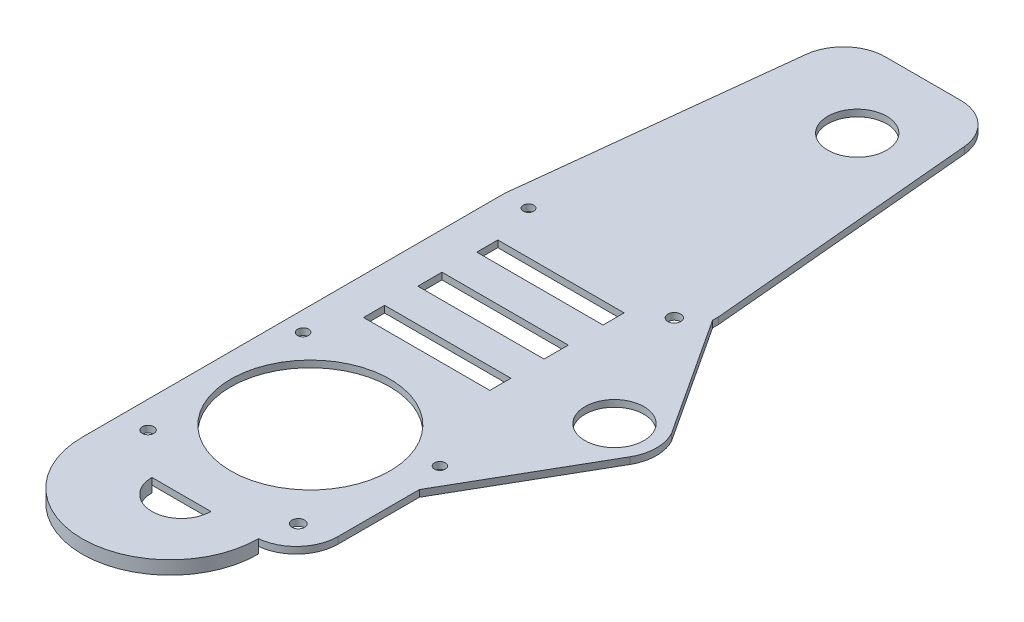
from build123d import *

# Parameters (mm, degrees)
SKETCH1_R           = 2.875
SKETCH1_R_2         = 7
BOSS_EXTRUDE1_DEPTH = 24.5875
SKETCH4_W           = 66.272407177
SKETCH4_H           = 27.800260981
CUT_EXTRUDE2_DEPTH  = 20
FILLET3_R           = 10
FILLET4_R           = 10
BOSS_EXTRUDE3_START = -1.5875
BOSS_EXTRUDE3_DEPTH = 1.5875
SKETCH7_R           = 7
CUT_EXTRUDE3_DEPTH  = 1.5875
CUT_EXTRUDE4_START  = -10
SKETCH8_R           = 3
SKETCH8_R_2         = 18.9
SKETCH8_R_3         = 2.875
SKETCH8_R_4         = 7
CUT_EXTRUDE4_DEPTH  = 10
SKETCH9_W           = 229.1070397
SKETCH9_H           = 361.266964835
SKETCH9_R           = 1.388229101
SKETCH9_R_2         = 1.483383261
SKETCH9_R_3         = 1.314910669
SKETCH9_R_4         = 1.248623853
SKETCH9_R_5         = 1.255629307
SKETCH9_R_6         = 1.53911217
CUT_EXTRUDE5_DEPTH  = 13
SKETCH10_W          = 29.988446547
SKETCH10_H          = 5
SKETCH10_H_2        = 5.75
CUT_EXTRUDE6_DEPTH  = 22
SKETCH11_R          = 5.236653548
CUT_EXTRUDE7_DEPTH  = 10
BOSS_EXTRUDE4_START = -1.59
BOSS_EXTRUDE4_DEPTH = 1.59
SKETCH13_R          = 7
CUT_EXTRUDE8_DEPTH  = 41
SKETCH14_W          = 61.491848917
SKETCH14_H          = 35.587491391
CUT_EXTRUDE9_DEPTH  = 20
FILLET5_R           = 10
SKETCH16_W          = 163.723031551
SKETCH16_H          = 22.872070304
CUT_EXTRUDE11_DEPTH = 35
FILLET6_R           = 10
SKETCH17_R          = 1.53911217
SKETCH17_R_2        = 1.255629307
SKETCH17_R_3        = 1.3
SKETCH17_R_4        = 1.314910669
SKETCH17_R_5        = 1.388229101
SKETCH17_R_6        = 1.5
CUT_EXTRUDE12_DEPTH = 42
CUT_EXTRUDE13_START = -30
SKETCH18_R          = 18.9
CUT_EXTRUDE13_DEPTH = 30
BOSS_EXTRUDE5_DEPTH = 3.175


with BuildPart() as part:
    # Sketch1 → Boss-Extrude1 (new body)
    with BuildSketch(Plane(origin=(0, 0, 0), x_dir=(1, 0, 0), z_dir=(0, 1, 0))):
        with BuildLine():
            Line((42.32729629, 228.6), (10.454309325, 228.6))
            Line((10.454309325, 228.6), (0, 135.362739137))
            Line((0, 135.362739137), (0, 0))
            Line((0, 0), (24.327009544, 0))
            Line((24.327009544, 0), (50.8, 0))
            Line((50.8, 0), (50.8, 64.87909603))
            Line((50.8, 64.87909603), (50.8, 87.423477361))
            Line((50.8, 87.423477361), (50.8, 98.200996728))
            ThreePointArc((50.8, 98.200996728), (50.4, 101.000996728), (50.8, 103.800996728))
            Line((50.8, 103.800996728), (50.8, 104.488200565))
            Line((50.8, 104.488200565), (50.8, 120.619222808))
            Line((50.8, 120.619222808), (50.8, 135.362739137))
            Line((50.8, 135.362739137), (42.32729629, 228.6))
        make_face()
        with Locations(Location((24.101759227, 108.78493524, 0), (0, 0, 270))):
            Circle(SKETCH1_R, mode=Mode.SUBTRACT)
        with Locations(Location((29.504213454, 189.557234372, 0), (0, 0, 270))):
            Circle(SKETCH1_R_2, mode=Mode.SUBTRACT)
    extrude(amount=BOSS_EXTRUDE1_DEPTH)

    # Sketch4 → Cut-Extrude2 (cut)
    with BuildSketch(Plane(origin=(0, 0, -228.6), x_dir=(-1, 0, 0), z_dir=(0, 0, -1))):
        with Locations((-28.174690156, -1.980940155)):
            Rectangle(SKETCH4_W, SKETCH4_H)
    extrude(amount=-CUT_EXTRUDE2_DEPTH, mode=Mode.SUBTRACT)

    # Fillet3
    fillet3_edges = [part.edges().sort_by_distance(p)[0] for p in [
        (44.144746445, 5.959595168, -208.6),
    ]]
    fillet(fillet3_edges, radius=FILLET3_R)

    # Fillet4
    fillet4_edges = [part.edges().sort_by_distance(p)[0] for p in [
        (50.8, 12.29375, 0),
        (0, 12.29375, 0),
        (8.211791854, 5.959595168, -208.6),
    ]]
    fillet(fillet4_edges, radius=FILLET4_R)

    # Sketch6 → Boss-Extrude3 (add)
    with BuildSketch(Plane(origin=(0, 24.5875, 0), x_dir=(1, 0, 0), z_dir=(0, 1, 0)).offset(BOSS_EXTRUDE3_START)):
        with BuildLine():
            Line((50.8, 135.362739137), (50.8, 103.800996728))
            ThreePointArc((50.8, 103.800996728), (50.4, 101.000996728), (50.8, 98.200996728))
            Line((50.8, 98.200996728), (50.8, 61.124243317))
            Line((50.8, 61.124243317), (69.258211507, 96.360728536))
            ThreePointArc((69.258211507, 96.360728536), (70.393157133, 101.370875786), (68.890940865, 106.283413148))
            Line((68.890940865, 106.283413148), (50.8, 135.362739137))
        make_face()
    extrude(amount=BOSS_EXTRUDE3_DEPTH)

    # Sketch7 → Cut-Extrude3 (cut)
    with BuildSketch(Plane(origin=(0, 24.5875, 0), x_dir=(1, 0, 0), z_dir=(0, 1, 0))):
        with Locations(Location((60.4, 101.000996728, 0), (0, 0, 270))):
            Circle(SKETCH7_R)
    extrude(amount=-CUT_EXTRUDE3_DEPTH, mode=Mode.SUBTRACT)

    # Sketch8 → Cut-Extrude4 (cut)
    with BuildSketch(Plane(origin=(0, 24.5875, 0), x_dir=(1, 0, 0), z_dir=(0, 1, 0)).offset(CUT_EXTRUDE4_START)):
        with BuildLine():
            Line((10.454309325, 228.6), (0, 135.362739137))
            Line((0, 135.362739137), (0, 10))
            ThreePointArc((0, 10), (2.928932188, 2.928932188), (10, 0))
            Line((10, 0), (40.8, 0))
            ThreePointArc((40.8, 0), (47.871067812, 2.928932188), (50.8, 10))
            Line((50.8, 10), (50.8, 61.124243317))
            Line((50.8, 61.124243317), (69.258211507, 96.360728536))
            ThreePointArc((69.258211507, 96.360728536), (70.393157133, 101.370875786), (68.890940865, 106.283413148))
            Line((68.890940865, 106.283413148), (50.8, 135.362739137))
            Line((50.8, 135.362739137), (42.32729629, 228.6))
            Line((42.32729629, 228.6), (10.454309325, 228.6))
        make_face()
        with Locations(Location((9.492033273, 118.909935242, 0), (0, 0, 270))):
            Circle(SKETCH8_R, mode=Mode.SUBTRACT)
        with Locations(Location((24.583834565, 64.593886665, 0), (0, 0, 270))):
            Circle(SKETCH8_R_2, mode=Mode.SUBTRACT)
        with Locations(Location((24.101759227, 108.78493524, 0), (0, 0, 270))):
            Circle(SKETCH8_R_3, mode=Mode.SUBTRACT)
        with Locations((60.4, 101.000996728)):
            Circle(SKETCH8_R_4, mode=Mode.SUBTRACT)
        with Locations(Location((29.504213454, 189.557234372, 0), (0, 0, 270))):
            Circle(SKETCH8_R_4, mode=Mode.SUBTRACT)
    extrude(amount=CUT_EXTRUDE4_DEPTH, mode=Mode.SUBTRACT)

    # Sketch9 → Cut-Extrude5 (cut)
    with BuildSketch(Plane.XZ):
        with Locations((19.903204009, -125.752229467)):
            Rectangle(SKETCH9_W, SKETCH9_H)
        with Locations(Location((6.335590122, -44.288799513, 0), (0, 0, 270))):
            Circle(SKETCH9_R, mode=Mode.SUBTRACT)
        with Locations(Location((43.447673368, -42.868436544, 0), (0, 0, 270))):
            Circle(SKETCH9_R_2, mode=Mode.SUBTRACT)
        with Locations(Location((4.659546827, -82.793173401, 0), (0, 0, 270))):
            Circle(SKETCH9_R_3, mode=Mode.SUBTRACT)
        with Locations(Location((48.400988852, -71.551011715, 0), (0, 0, 270))):
            Circle(SKETCH9_R_4, mode=Mode.SUBTRACT)
        with Locations(Location((5.88467603, -135.103145298, 0), (0, 0, 270))):
            Circle(SKETCH9_R_5, mode=Mode.SUBTRACT)
        with Locations(Location((45.747747887, -129.863467374, 0), (0, 0, 270))):
            Circle(SKETCH9_R_6, mode=Mode.SUBTRACT)
    extrude(amount=-CUT_EXTRUDE5_DEPTH, mode=Mode.SUBTRACT)

    # Sketch10 → Cut-Extrude6 (cut)
    with BuildSketch(Plane(origin=(0, 24.5875, 0), x_dir=(1, 0, 0), z_dir=(0, 1, 0))):
        with Locations((23.779803557, 122.41493524)):
            Rectangle(SKETCH10_W, SKETCH10_H)
        with Locations((23.779803557, 108.78493524)):
            Rectangle(SKETCH10_W, SKETCH10_H_2)
        with Locations((23.779803557, 95.528937895)):
            Rectangle(SKETCH10_W, SKETCH10_H)
    extrude(amount=-CUT_EXTRUDE6_DEPTH, mode=Mode.SUBTRACT)

    # Sketch11 → Cut-Extrude7 (cut)
    with BuildSketch(Plane(origin=(0, 24.5875, 0), x_dir=(1, 0, 0), z_dir=(0, 1, 0))):
        with Locations((8.535526315, 118.29502971)):
            Circle(SKETCH11_R)
    extrude(amount=-CUT_EXTRUDE7_DEPTH, mode=Mode.SUBTRACT)

    # Sketch12 → Boss-Extrude4 (add)
    with BuildSketch(Plane(origin=(0, 14.5875, 0), x_dir=(1, 0, 0), z_dir=(0, 1, 0)).offset(BOSS_EXTRUDE4_START)):
        with BuildLine():
            Line((68.287536191, 107.148091395), (50.8, 133.900488173))
            Line((50.8, 133.900488173), (50.8, 103.800996728))
            ThreePointArc((50.8, 103.800996728), (58.520134646, 110.822712782), (68.287536191, 107.148091395))
        make_face()
        with BuildLine():
            Line((69.19540964, 105.759228466), (68.287536191, 107.148091395))
            ThreePointArc((68.287536191, 107.148091395), (58.520134646, 110.822712782), (50.8, 103.800996728))
            ThreePointArc((50.8, 103.800996728), (50.4, 101.000996728), (50.8, 98.200996728))
            ThreePointArc((50.8, 98.200996728), (59.211240578, 91.07190558), (69.067690563, 96.013899345))
            ThreePointArc((69.067690563, 96.013899345), (70.061182785, 98.419999404), (70.4, 101.000996728))
            ThreePointArc((70.4, 101.000996728), (70.094175994, 103.455167016), (69.19540964, 105.759228466))
        make_face()
        with BuildLine():
            ThreePointArc((69.067690563, 96.013899345), (59.211240578, 91.07190558), (50.8, 98.200996728))
            Line((50.8, 98.200996728), (50.8, 64.264230765))
            Line((50.8, 64.264230765), (69.067690563, 96.013899345))
        make_face()
    extrude(amount=BOSS_EXTRUDE4_DEPTH)

    # Sketch13 → Cut-Extrude8 (cut)
    with BuildSketch(Plane(origin=(0, 14.5875, 0), x_dir=(1, 0, 0), z_dir=(0, 1, 0))):
        with Locations(Location((60.4, 101.000996728, 0), (0, 0, 270))):
            Circle(SKETCH13_R)
    extrude(amount=-CUT_EXTRUDE8_DEPTH, mode=Mode.SUBTRACT)

    # Sketch14 → Cut-Extrude9 (cut)
    with BuildSketch(Plane(origin=(0, 0, -228.6), x_dir=(-1, 0, 0), z_dir=(0, 0, -1))):
        with Locations((-33.296946078, 21.381494753)):
            Rectangle(SKETCH14_W, SKETCH14_H)
    extrude(amount=-CUT_EXTRUDE9_DEPTH, mode=Mode.SUBTRACT)

    # Fillet5
    fillet5_edges = [part.edges().sort_by_distance(p)[0] for p in [
        (44.144746445, 13.79375, -208.6),
        (8.211791854, 13.79375, -208.6),
    ]]
    fillet(fillet5_edges, radius=FILLET5_R)

    # Sketch16 → Cut-Extrude11 (cut)
    with BuildSketch(Plane.XY):
        with Locations((6.935844153, 9.456999915)):
            Rectangle(SKETCH16_W, SKETCH16_H)
    extrude(amount=-CUT_EXTRUDE11_DEPTH, mode=Mode.SUBTRACT)

    # Fillet6
    fillet6_edges = [part.edges().sort_by_distance(p)[0] for p in [
        (0, 13.79375, -35),
        (50.8, 13.79375, -35),
    ]]
    fillet(fillet6_edges, radius=FILLET6_R)

    # Sketch17 → Cut-Extrude12 (cut)
    with BuildSketch(Plane.XZ):
        with Locations(Location((45.747747887, -129.863467374, 0), (0, 0, 270))):
            Circle(SKETCH17_R)
        with Locations(Location((5.88467603, -135.103145298, 0), (0, 0, 270))):
            Circle(SKETCH17_R_2)
        with Locations(Location((48.400988852, -71.551011715, 0), (0, 0, 270))):
            Circle(SKETCH17_R_3)
        with Locations(Location((4.659546827, -82.793173401, 0), (0, 0, 270))):
            Circle(SKETCH17_R_4)
        with Locations(Location((6.335590122, -44.288799513, 0), (0, 0, 270))):
            Circle(SKETCH17_R_5)
        with Locations(Location((43.447673368, -42.868436544, 0), (0, 0, 270))):
            Circle(SKETCH17_R_6)
    extrude(amount=-CUT_EXTRUDE12_DEPTH, mode=Mode.SUBTRACT)

    # Sketch18 → Cut-Extrude13 (cut)
    with BuildSketch(Plane(origin=(0, 24.5875, 0), x_dir=(1, 0, 0), z_dir=(0, 1, 0)).offset(CUT_EXTRUDE13_START)):
        with Locations(Location((24.583834565, 64.593886665, 0), (0, 0, 270))):
            Circle(SKETCH18_R)
    extrude(amount=CUT_EXTRUDE13_DEPTH, mode=Mode.SUBTRACT)

    # Sketch19 → Boss-Extrude5 (add)
    with BuildSketch(Plane(origin=(0, 14.5875, 0), x_dir=(1, 0, 0), z_dir=(0, 1, 0))):
        with BuildLine():
            ThreePointArc((10, 35), (2.928932188, 37.928932188), (0, 45))
            Line((0, 45), (0, 35))
            ThreePointArc((0, 35), (20.920362417, 14.10428472), (41.791401522, 35.049265202))
            ThreePointArc((41.791401522, 35.049265202), (41.296312411, 35.012323894), (40.8, 35))
            Line((40.8, 35), (30.546186564, 35))
            ThreePointArc((30.546186564, 35), (23.546186564, 28), (16.546186564, 35))
            Line((16.546186564, 35), (10, 35))
        make_face()
    extrude(amount=-BOSS_EXTRUDE5_DEPTH)


solid = part.part
